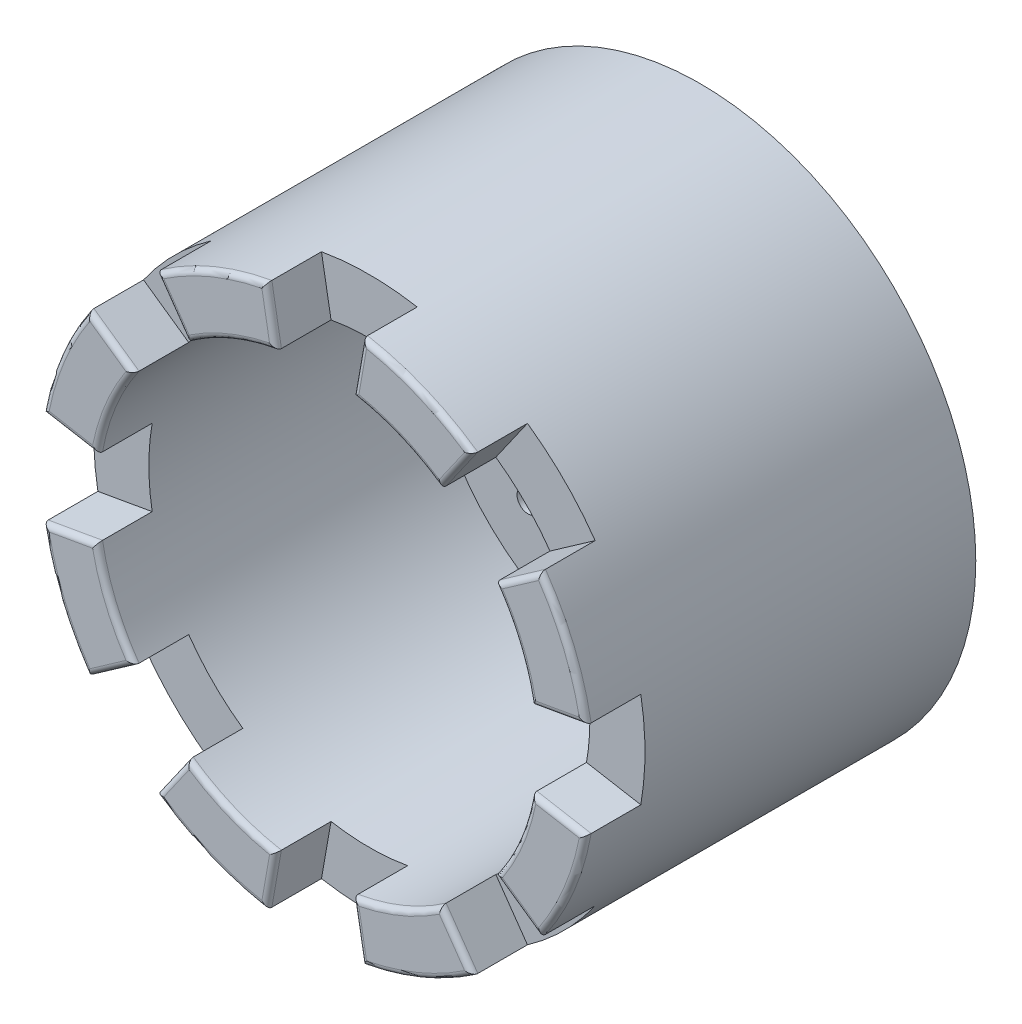
from build123d import *

# Parameters (mm, degrees)
CROQUIS1_R              = 50
CROQUIS1_R_2            = 15.5
SALIENTE_EXTRUIR1_DEPTH = 70
CROQUIS2_R              = 40
CORTAR_EXTRUIR1_DEPTH   = 50
CROQUIS3_R              = 17.5
CORTAR_EXTRUIR2_DEPTH   = 10
CROQUIS4_R              = 40
CROQUIS4_R_2            = 15.5
CORTAR_EXTRUIR3_DEPTH   = 10
CROQUIS5_R              = 2
CORTAR_EXTRUIR4_DEPTH   = 93.736184955
CROQUIS6_R              = 5
CORTAR_EXTRUIR5_DEPTH   = 5
CORTAR_EXTRUIR6_DEPTH   = 10
REDONDEO2_R             = 1


with BuildPart() as part:
    # Croquis1 → Saliente-Extruir1 (new body)
    with BuildSketch(Plane.XY):
        Circle(CROQUIS1_R)
        Circle(CROQUIS1_R_2, mode=Mode.SUBTRACT)
    extrude(amount=SALIENTE_EXTRUIR1_DEPTH)

    # Croquis2 → Cortar-Extruir1 (cut)
    with BuildSketch(Plane.XY.offset(70)):
        Circle(CROQUIS2_R)
    extrude(amount=-CORTAR_EXTRUIR1_DEPTH, mode=Mode.SUBTRACT)

    # Croquis3 → Cortar-Extruir2 (cut)
    with BuildSketch(Plane(origin=(0, 0, 0), x_dir=(-1, 0, 0), z_dir=(0, 0, -1))):
        Circle(CROQUIS3_R)
    extrude(amount=-CORTAR_EXTRUIR2_DEPTH, mode=Mode.SUBTRACT)

    # Croquis4 → Cortar-Extruir3 (cut)
    # profile 1 of 2: a face of its own
    with BuildSketch(Plane.XY.offset(20)):
        Circle(CROQUIS4_R)
        with BuildLine():
            Line((-2.5, 27.386127875), (-2.5, 32.5))
            Line((-2.5, 32.5), (2.5, 32.5))
            Line((2.5, 32.5), (2.5, 27.386127875))
            ThreePointArc((2.5, 27.386127875), (19.445436483, 19.445436483), (27.386127875, 2.5))
            Line((27.386127875, 2.5), (32.5, 2.5))
            Line((32.5, 2.5), (32.5, -2.5))
            Line((32.5, -2.5), (27.386127875, -2.5))
            ThreePointArc((27.386127875, -2.5), (19.445436483, -19.445436483), (2.5, -27.386127875))
            Line((2.5, -27.386127875), (2.5, -32.5))
            Line((2.5, -32.5), (-2.5, -32.5))
            Line((-2.5, -32.5), (-2.5, -27.386127875))
            ThreePointArc((-2.5, -27.386127875), (-19.445436483, -19.445436483), (-27.386127875, -2.5))
            Line((-27.386127875, -2.5), (-32.5, -2.5))
            Line((-32.5, -2.5), (-32.5, 2.5))
            Line((-32.5, 2.5), (-27.386127875, 2.5))
            ThreePointArc((-27.386127875, 2.5), (-19.445436483, 19.445436483), (-2.5, 27.386127875))
        make_face(mode=Mode.SUBTRACT)
    # profile 2 of 2: a face of its own
    with BuildSketch(Plane.XY.offset(20)):
        with BuildLine():
            Line((-2.5, 22.5), (-2.5, 27.386127875))
            ThreePointArc((-2.5, 27.386127875), (-19.445436483, 19.445436483), (-27.386127875, 2.5))
            Line((-27.386127875, 2.5), (-22.5, 2.5))
            Line((-22.5, 2.5), (-22.5, -2.5))
            Line((-22.5, -2.5), (-27.386127875, -2.5))
            ThreePointArc((-27.386127875, -2.5), (-19.445436483, -19.445436483), (-2.5, -27.386127875))
            Line((-2.5, -27.386127875), (-2.5, -22.5))
            Line((-2.5, -22.5), (2.5, -22.5))
            Line((2.5, -22.5), (2.5, -27.386127875))
            ThreePointArc((2.5, -27.386127875), (19.445436483, -19.445436483), (27.386127875, -2.5))
            Line((27.386127875, -2.5), (22.5, -2.5))
            Line((22.5, -2.5), (22.5, 2.5))
            Line((22.5, 2.5), (27.386127875, 2.5))
            ThreePointArc((27.386127875, 2.5), (19.445436483, 19.445436483), (2.5, 27.386127875))
            Line((2.5, 27.386127875), (2.5, 22.5))
            Line((2.5, 22.5), (-2.5, 22.5))
        make_face()
        Circle(CROQUIS4_R_2, mode=Mode.SUBTRACT)
    extrude(amount=-CORTAR_EXTRUIR3_DEPTH, mode=Mode.SUBTRACT)

    # Croquis5 → Cortar-Extruir4 (cut, through all)
    with BuildSketch(Plane.XY.offset(10)):
        with Locations((21.213203436, 21.213203436)):
            Circle(CROQUIS5_R)
        with Locations((21.213203436, -21.213203436)):
            Circle(CROQUIS5_R)
        with Locations((-21.213203436, -21.213203436)):
            Circle(CROQUIS5_R)
        with Locations((-21.213203436, 21.213203436)):
            Circle(CROQUIS5_R)
    extrude(amount=-CORTAR_EXTRUIR4_DEPTH, mode=Mode.SUBTRACT)

    # Croquis6 → Cortar-Extruir5 (cut)
    with BuildSketch(Plane(origin=(0, 0, 0), x_dir=(-1, 0, 0), z_dir=(0, 0, -1))):
        with Locations((-21.213203436, 21.213203436)):
            Circle(CROQUIS6_R)
        with Locations((21.486974797, 21.486974797)):
            Circle(CROQUIS6_R)
        with Locations((21.760746158, -21.213203436)):
            Circle(CROQUIS6_R)
        with Locations((-20.939432074, -21.486974797)):
            Circle(CROQUIS6_R)
    extrude(amount=-CORTAR_EXTRUIR5_DEPTH, mode=Mode.SUBTRACT)

    # Croquis7 → Cortar-Extruir6 (cut)
    with BuildSketch(Plane.XY.offset(70)):
        with BuildLine():
            ThreePointArc((-6.945927107, 39.39231012), (-3.48622971, 39.847787924), (0, 40))
            Line((0, 40), (0, 50))
            ThreePointArc((0, 50), (-4.357787137, 49.809734905), (-8.682408883, 49.240387651))
            Line((-8.682408883, 49.240387651), (-6.945927107, 39.39231012))
        make_face()
        with BuildLine():
            Line((0, 50), (0, 40))
            ThreePointArc((0, 40), (3.48622971, 39.847787924), (6.945927107, 39.39231012))
            Line((6.945927107, 39.39231012), (8.682408883, 49.240387651))
            ThreePointArc((8.682408883, 49.240387651), (4.357787137, 49.809734905), (0, 50))
        make_face()
        with BuildLine():
            ThreePointArc((22.943057454, 32.766081772), (28.284271247, 28.284271247), (32.766081772, 22.943057454))
            Line((32.766081772, 22.943057454), (40.957602214, 28.678821818))
            ThreePointArc((40.957602214, 28.678821818), (35.355339059, 35.355339059), (28.678821818, 40.957602214))
            Line((28.678821818, 40.957602214), (22.943057454, 32.766081772))
        make_face()
        with BuildLine():
            ThreePointArc((40, 0), (39.847787924, -3.48622971), (39.39231012, -6.945927107))
            Line((39.39231012, -6.945927107), (49.240387651, -8.682408883))
            ThreePointArc((49.240387651, -8.682408883), (49.809734905, -4.357787137), (50, 0))
            ThreePointArc((50, 0), (49.809734905, 4.357787137), (49.240387651, 8.682408883))
            Line((49.240387651, 8.682408883), (39.39231012, 6.945927107))
            ThreePointArc((39.39231012, 6.945927107), (39.847787924, 3.48622971), (40, 0))
        make_face()
        with BuildLine():
            ThreePointArc((32.766081772, -22.943057454), (28.284271247, -28.284271247), (22.943057454, -32.766081772))
            Line((22.943057454, -32.766081772), (28.678821818, -40.957602214))
            ThreePointArc((28.678821818, -40.957602214), (35.355339059, -35.355339059), (40.957602214, -28.678821818))
            Line((40.957602214, -28.678821818), (32.766081772, -22.943057454))
        make_face()
        with BuildLine():
            ThreePointArc((-32.766081772, 22.943057454), (-28.284271247, 28.284271247), (-22.943057454, 32.766081772))
            Line((-22.943057454, 32.766081772), (-28.678821818, 40.957602214))
            ThreePointArc((-28.678821818, 40.957602214), (-35.355339059, 35.355339059), (-40.957602214, 28.678821818))
            Line((-40.957602214, 28.678821818), (-32.766081772, 22.943057454))
        make_face()
        with BuildLine():
            ThreePointArc((-39.39231012, -6.945927107), (-40, 0), (-39.39231012, 6.945927107))
            Line((-39.39231012, 6.945927107), (-49.240387651, 8.682408883))
            ThreePointArc((-49.240387651, 8.682408883), (-50, 0), (-49.240387651, -8.682408883))
            Line((-49.240387651, -8.682408883), (-39.39231012, -6.945927107))
        make_face()
        with BuildLine():
            ThreePointArc((-22.943057454, -32.766081772), (-28.284271247, -28.284271247), (-32.766081772, -22.943057454))
            Line((-32.766081772, -22.943057454), (-40.957602214, -28.678821818))
            ThreePointArc((-40.957602214, -28.678821818), (-35.355339059, -35.355339059), (-28.678821818, -40.957602214))
            Line((-28.678821818, -40.957602214), (-22.943057454, -32.766081772))
        make_face()
        with BuildLine():
            ThreePointArc((6.945927107, -39.39231012), (0, -40), (-6.945927107, -39.39231012))
            Line((-6.945927107, -39.39231012), (-8.682408883, -49.240387651))
            ThreePointArc((-8.682408883, -49.240387651), (0, -50), (8.682408883, -49.240387651))
            Line((8.682408883, -49.240387651), (6.945927107, -39.39231012))
        make_face()
    extrude(amount=-CORTAR_EXTRUIR6_DEPTH, mode=Mode.SUBTRACT)

    # Redondeo2
    redondeo2_edges = [part.edges().sort_by_distance(p)[0] for p in [
        (36.9551813, 15.307337295, 70),
        (15.307337295, 36.9551813, 70),
        (-15.307337295, 36.9551813, 70),
        (-36.9551813, 15.307337295, 70),
        (-36.9551813, -15.307337295, 70),
        (-15.307337295, -36.9551813, 70),
        (15.307337295, -36.9551813, 70),
        (36.9551813, -15.307337295, 70),
        (19.134171618, 46.193976626, 70),
        (-19.134171618, 46.193976626, 70),
        (-46.193976626, 19.134171618, 70),
        (-46.193976626, -19.134171618, 70),
        (-19.134171618, -46.193976626, 70),
        (19.134171618, -46.193976626, 70),
        (46.193976626, -19.134171618, 70),
        (-36.861841993, 25.810939636, 70),
        (-25.810939636, 36.861841993, 70),
        (36.861841993, -25.810939636, 70),
        (25.810939636, -36.861841993, 70),
        (44.316348886, 7.814167995, 70),
        (44.316348886, -7.814167995, 70),
        (25.810939636, 36.861841993, 70),
        (36.861841993, 25.810939636, 70),
        (-44.316348886, -7.814167995, 70),
        (-44.316348886, 7.814167995, 70),
        (-25.810939636, -36.861841993, 70),
        (-36.861841993, -25.810939636, 70),
        (7.814167995, -44.316348886, 70),
        (-7.814167995, -44.316348886, 70),
        (-7.814167995, 44.316348886, 70),
        (7.814167995, 44.316348886, 70),
        (-22.5, 0, 20),
        (2.5, -27.5, 20),
        (32.5, 0, 20),
        (27.5, 2.5, 20),
        (-2.5, 27.5, 20),
        (-27.5, -2.5, 20),
        (0, -22.5, 20),
        (0, 22.5, 20),
        (2.5, 27.5, 20),
        (0, 32.5, 20),
        (46.193976626, 19.134171618, 70),
        (27.5, -2.5, 20),
        (22.5, 0, 20),
        (-2.5, -27.5, 20),
        (0, -32.5, 20),
        (-32.5, 0, 20),
        (-27.5, 2.5, 20),
    ]]
    fillet(redondeo2_edges, radius=REDONDEO2_R)


solid = part.part
